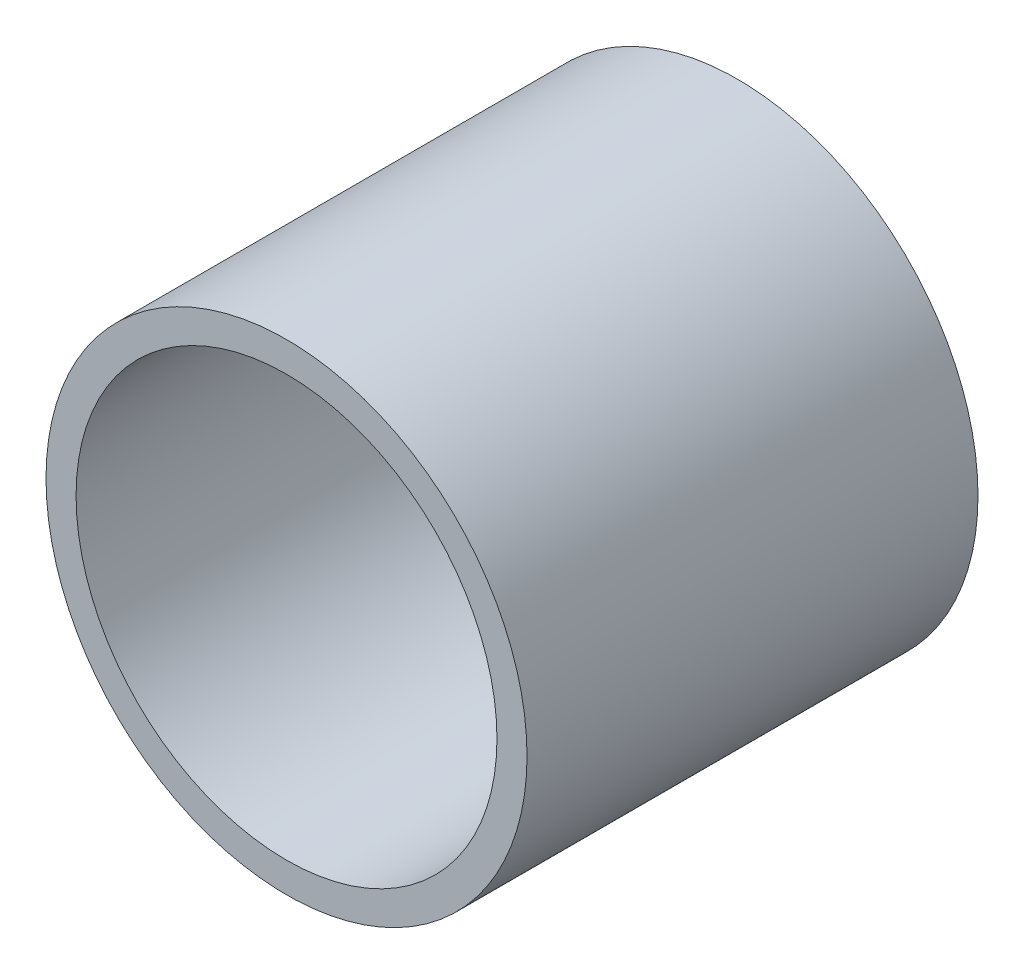
from build123d import *

# Parameters (mm, degrees)
SKETCH1_W = 3
SKETCH1_H = 0.2


with BuildPart() as part:
    # Sketch1 → Revolve1 (revolve)
    with BuildSketch(Plane(origin=(0, 0, 0), x_dir=(0, 0, -1), z_dir=(1, 0, 0)), mode=Mode.PRIVATE) as revolve1_sk:
        with Locations((0, 1.335431235)):
            Rectangle(SKETCH1_W, SKETCH1_H)
    revolve(revolve1_sk.sketch.rotate(Axis((0, -0.164568765, -0.499996), (0, 0, -1)), 90), axis=Axis((0, -0.164568765, -0.499996), (0, 0, -1)))


solid = part.part
